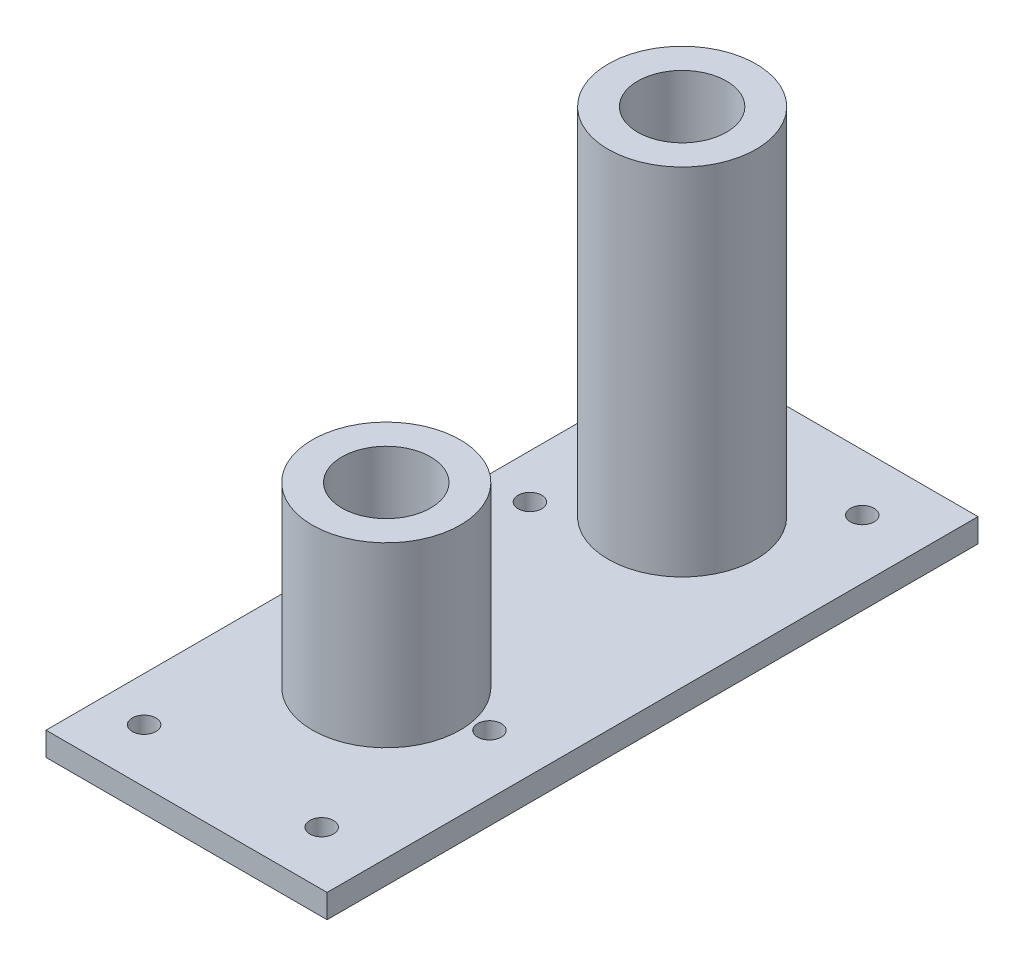
from build123d import *

# Parameters (mm, degrees)
SKETCH1_W           = 47.5
SKETCH1_H           = 110
SKETCH1_R           = 2
SKETCH1_W_2         = 10
SKETCH1_H_2         = 10
BOSS_EXTRUDE1_DEPTH = 4
SKETCH2_R           = 12.5
SKETCH2_R_2         = 7.5
BOSS_EXTRUDE2_DEPTH = 30
SKETCH4_R           = 12.5
SKETCH4_R_2         = 7.5
BOSS_EXTRUDE3_DEPTH = 60


with BuildPart() as part:
    # Sketch1 → Boss-Extrude1 (new body)
    with BuildSketch(Plane(origin=(0, 0, 0), x_dir=(1, 0, 0), z_dir=(0, 1, 0))):
        with Locations((-12.897727273, -28.125)):
            Rectangle(SKETCH1_W, SKETCH1_H)
        with Locations(Location((0.852272727, 17.315, 0), (0, 0, 270))):
            Circle(SKETCH1_R, mode=Mode.SUBTRACT)
        with Locations(Location((-29.147727273, -8.845, 0), (0, 0, 270))):
            Circle(SKETCH1_R, mode=Mode.SUBTRACT)
        with Locations(Location((0.852272727, -45.685, 0), (0, 0, 270))):
            Circle(SKETCH1_R, mode=Mode.SUBTRACT)
        with Locations(Location((0.852272727, -74.045, 0), (0, 0, 270))):
            Circle(SKETCH1_R, mode=Mode.SUBTRACT)
        with Locations(Location((-29.147727273, -74.045, 0), (0, 0, 270))):
            Circle(SKETCH1_R, mode=Mode.SUBTRACT)
        with Locations((-14.147727273, 1.875)):
            Rectangle(SKETCH1_W_2, SKETCH1_H_2, mode=Mode.SUBTRACT)
        with Locations((-14.147727273, -48.125)):
            Rectangle(SKETCH1_W_2, SKETCH1_H_2, mode=Mode.SUBTRACT)
    extrude(amount=-BOSS_EXTRUDE1_DEPTH)

    # Sketch2 → Boss-Extrude2 (add)
    with BuildSketch(Plane(origin=(0, 0, 0), x_dir=(1, 0, 0), z_dir=(0, 1, 0))):
        with Locations(Location((-14.147727273, -48.125, 0), (0, 0, 270))):
            Circle(SKETCH2_R)
        with Locations(Location((-14.147727273, -48.125, 0), (0, 0, 270))):
            Circle(SKETCH2_R_2, mode=Mode.SUBTRACT)
    extrude(amount=BOSS_EXTRUDE2_DEPTH)

    # Sketch4 → Boss-Extrude3 (add)
    with BuildSketch(Plane(origin=(0, 0, 0), x_dir=(1, 0, 0), z_dir=(0, 1, 0))):
        with Locations(Location((-14.147727273, 1.875, 0), (0, 0, 270))):
            Circle(SKETCH4_R)
        with Locations(Location((-14.147727273, 1.875, 0), (0, 0, 270))):
            Circle(SKETCH4_R_2, mode=Mode.SUBTRACT)
    extrude(amount=BOSS_EXTRUDE3_DEPTH)


solid = part.part
